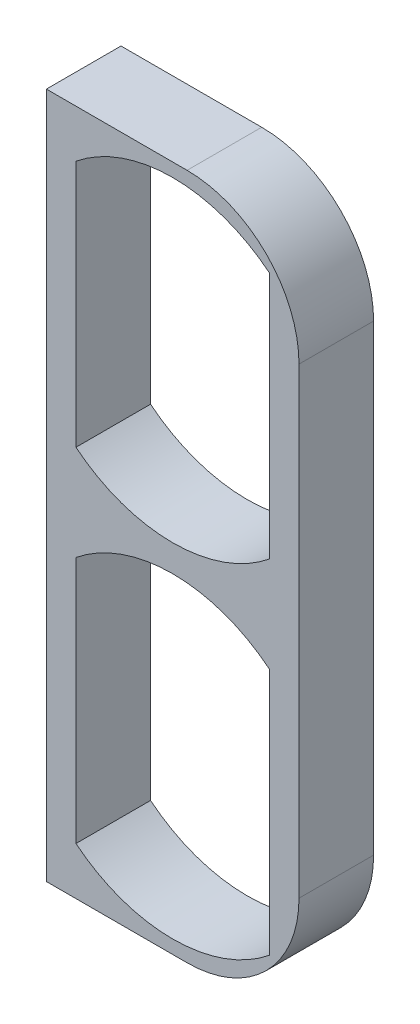
from build123d import *

# Parameters (mm, degrees)
SKETCH1_W           = 47.5742
SKETCH1_H           = 58.42
BOSS_EXTRUDE1_DEPTH = 12.7
CUT_EXTRUDE1_REACH  = 41.753
SKETCH4_W           = 12.7
SKETCH4_H           = 116.84
CUT_EXTRUDE2_DEPTH  = 2.286
SKETCH5_W           = 12.7
SKETCH5_H           = 116.84
CUT_EXTRUDE3_DEPTH  = 2.286
FILLET1_R           = 19.05


with BuildPart() as part:
    # Sketch1 → Boss-Extrude1 (new body)
    with BuildSketch(Plane.XY):
        Rectangle(SKETCH1_W, SKETCH1_H)
    extrude(amount=BOSS_EXTRUDE1_DEPTH)

    # Sketch3 → Cut-Extrude1 (cut, up to next)
    with BuildSketch(Plane.XY.offset(12.7), mode=Mode.PRIVATE) as cut_extrude1_sk1:
        with BuildLine():
            ThreePointArc((-16.471621861, -21.087745183), (-8.737508184, -25.421809301), (0, -26.924))
            Line((0, -26.924), (0, 0))
            Line((0, 0), (0, 26.924))
            ThreePointArc((0, 26.924), (-8.737508184, 25.421809301), (-16.471621861, 21.087745183))
            Line((-16.471621861, 21.087745183), (-16.471621861, -21.087745183))
        make_face()
    cut_extrude1_tool1 = extrude(cut_extrude1_sk1.sketch, amount=-CUT_EXTRUDE1_REACH, mode=Mode.PRIVATE) & part.part
    # Sketch3 → Cut-Extrude1 (cut, up to next)
    with BuildSketch(Plane.XY.offset(12.7), mode=Mode.PRIVATE) as cut_extrude1_sk2:
        with BuildLine():
            Line((0, 0), (0, -26.924))
            ThreePointArc((0, -26.924), (8.737508184, -25.421809301), (16.471621861, -21.087745183))
            Line((16.471621861, -21.087745183), (16.471621861, 21.087745183))
            ThreePointArc((16.471621861, 21.087745183), (8.737508184, 25.421809301), (0, 26.924))
            Line((0, 26.924), (0, 0))
        make_face()
    cut_extrude1_tool2 = extrude(cut_extrude1_sk2.sketch, amount=-CUT_EXTRUDE1_REACH, mode=Mode.PRIVATE) & part.part
    add(cut_extrude1_tool1.solids().sort_by_distance((-7.924897, 0, 12.7))[0], mode=Mode.SUBTRACT)
    add(cut_extrude1_tool2.solids().sort_by_distance((7.924897, 0, 12.7))[0], mode=Mode.SUBTRACT)

    # Mirror1: part across plane


with BuildPart() as part_1:
    add(part.part)
    add(part.part.mirror(Plane(origin=(-23.7871, 29.21, 12.7), x_dir=(0, 0, 1), z_dir=(0, -1, 0))))

    # Sketch4 → Cut-Extrude2 (cut)
    with BuildSketch(Plane(origin=(23.7871, 0, 0), x_dir=(0, 0, -1), z_dir=(1, 0, 0))):
        with Locations((-6.35, 29.21)):
            Rectangle(SKETCH4_W, SKETCH4_H)
    extrude(amount=-CUT_EXTRUDE2_DEPTH, mode=Mode.SUBTRACT)

    # Sketch5 → Cut-Extrude3 (cut)
    with BuildSketch(Plane.ZY.offset(23.7871)):
        with Locations((6.35, 29.21)):
            Rectangle(SKETCH5_W, SKETCH5_H)
    extrude(amount=-CUT_EXTRUDE3_DEPTH, mode=Mode.SUBTRACT)

    # Fillet1
    fillet1_edges = [part_1.edges().sort_by_distance(p)[0] for p in [
        (21.5011, 87.63, 6.35),
        (21.5011, -29.21, 6.35),
    ]]
    fillet(fillet1_edges, radius=FILLET1_R)


solid = part_1.part
